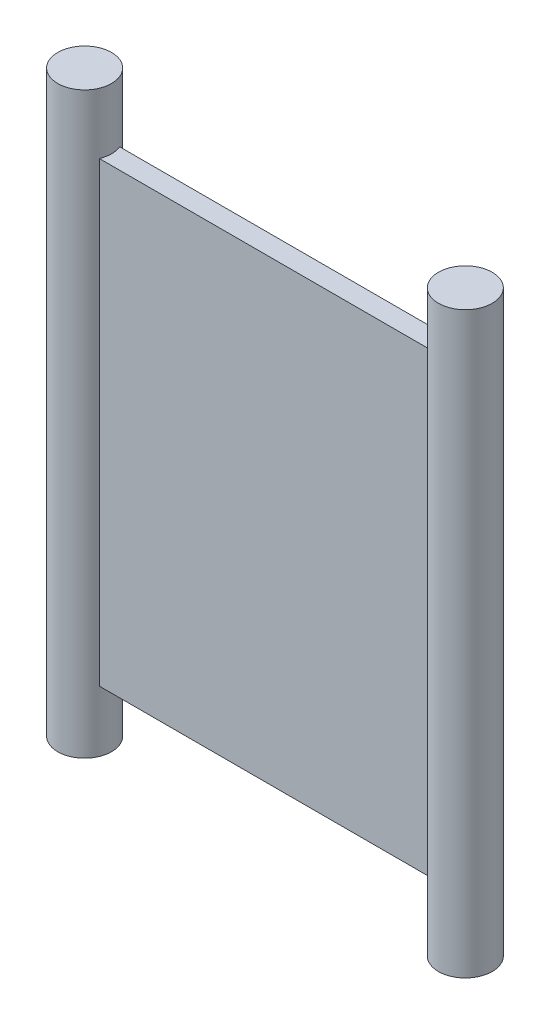
from build123d import *

# Parameters (mm, degrees)
SKETCH1_W           = 18.746
SKETCH1_H           = 1
BOSS_EXTRUDE1_DEPTH = 22.5
SKETCH2_R           = 1.325
BOSS_EXTRUDE2_DEPTH = 14.25


with BuildPart() as part:
    # Sketch1 → Boss-Extrude1 (new body)
    with BuildSketch(Plane(origin=(0, 0, 0), x_dir=(1, 0, 0), z_dir=(0, 1, 0))):
        Rectangle(SKETCH1_W, SKETCH1_H)
    extrude(amount=BOSS_EXTRUDE1_DEPTH)

    # Sketch2 → Boss-Extrude2 (add, symmetric)
    with BuildSketch(Plane(origin=(0, 11.25, 0), x_dir=(1, 0, 0), z_dir=(0, 1, 0))):
        with Locations(Location((-9.373, 0, 0), (0, 0, 270))):
            Circle(SKETCH2_R)
        with Locations(Location((9.373, 0, 0), (0, 0, 270))):
            Circle(SKETCH2_R)
    extrude(amount=BOSS_EXTRUDE2_DEPTH, both=True)


solid = part.part
